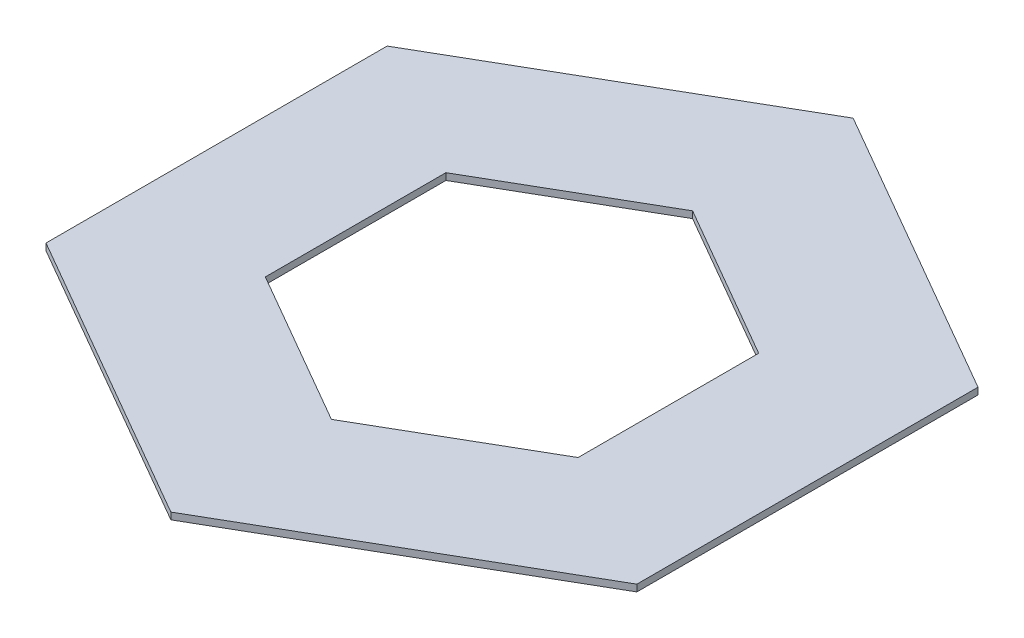
from build123d import *

# Parameters (mm, degrees)
RESSALTO_EXTRUS_O1_DEPTH = 1
CORTE_EXTRUS_O1_DEPTH    = 67.638154236


with BuildPart() as part:
    # Esboço1 → Ressalto-extrusão1 (new body)
    with BuildSketch(Plane(origin=(0, 0, 0), x_dir=(1, 0, 0), z_dir=(0, 1, 0))):
        Polygon((-43.62, 11.068078609), (-43.62, 25.184018742), (-12.224762753, 43.310067418), (0, 50.368037484), (31.395237247, 32.241988808), (43.62, 25.184018742), (43.62, -11.068078609), (43.62, -25.184018742), (12.224762753, -43.310067418), (0, -50.368037484), (-31.395237247, -32.241988808), (-43.62, -25.184018742), align=None)
    extrude(amount=RESSALTO_EXTRUS_O1_DEPTH)

    # Esboço2 → Corte-extrusão1 (cut, through all)
    with BuildSketch(Plane.XZ):
        Polygon((23.09165742, 13.331974628), (0, 26.663949255), (-23.09165742, 13.331974628), (-23.09165742, -13.331974628), (0, -26.663949255), (23.09165742, -13.331974628), align=None)
    extrude(amount=-CORTE_EXTRUS_O1_DEPTH, mode=Mode.SUBTRACT)


solid = part.part
